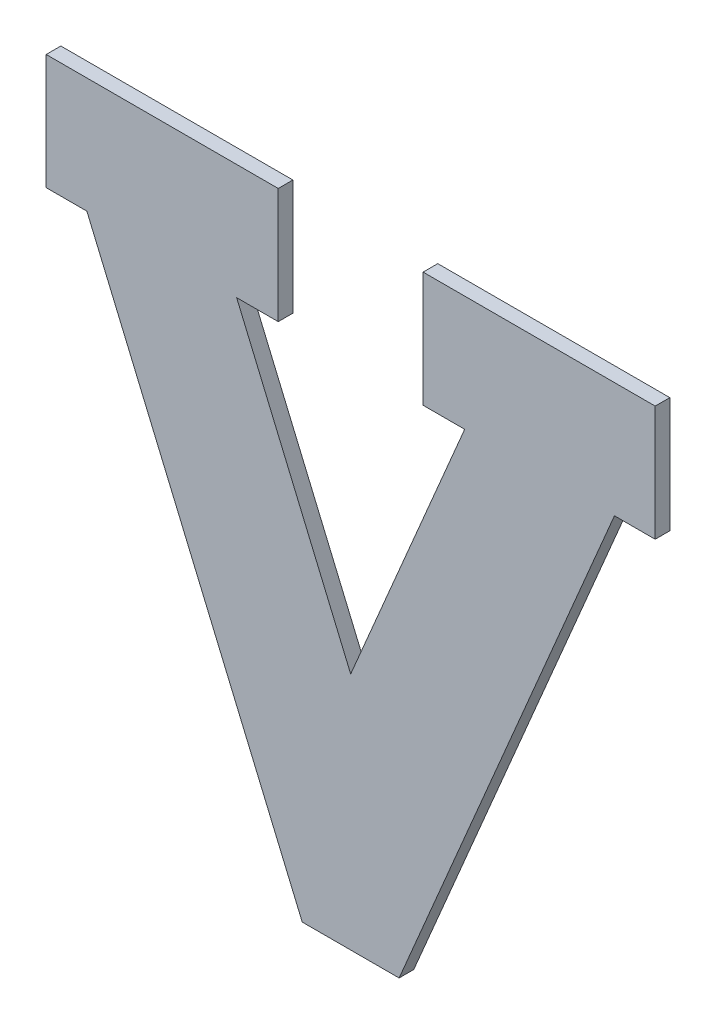
from build123d import *

# Parameters (mm, degrees)
BOSS_EXTRUDE1_DEPTH = 12.7


with BuildPart() as part:
    # Sketch1 → Boss-Extrude1 (new body)
    with BuildSketch(Plane.XY):
        Polygon((234.547862173, 12.7), (47.96924583, 452.806030315), (12.7, 452.806030315), (12.7, 552.75437456), (213.758878539, 552.75437456), (213.758878539, 452.806030315), (177.730987009, 452.806030315), (276.517141205, 219.786925418), (375.3032954, 452.806030315), (339.27540387, 452.806030315), (339.27540387, 552.75437456), (540.334282409, 552.75437456), (540.334282409, 452.806030315), (505.065036579, 452.806030315), (318.486420236, 12.7), align=None)
    extrude(amount=BOSS_EXTRUDE1_DEPTH)


solid = part.part
